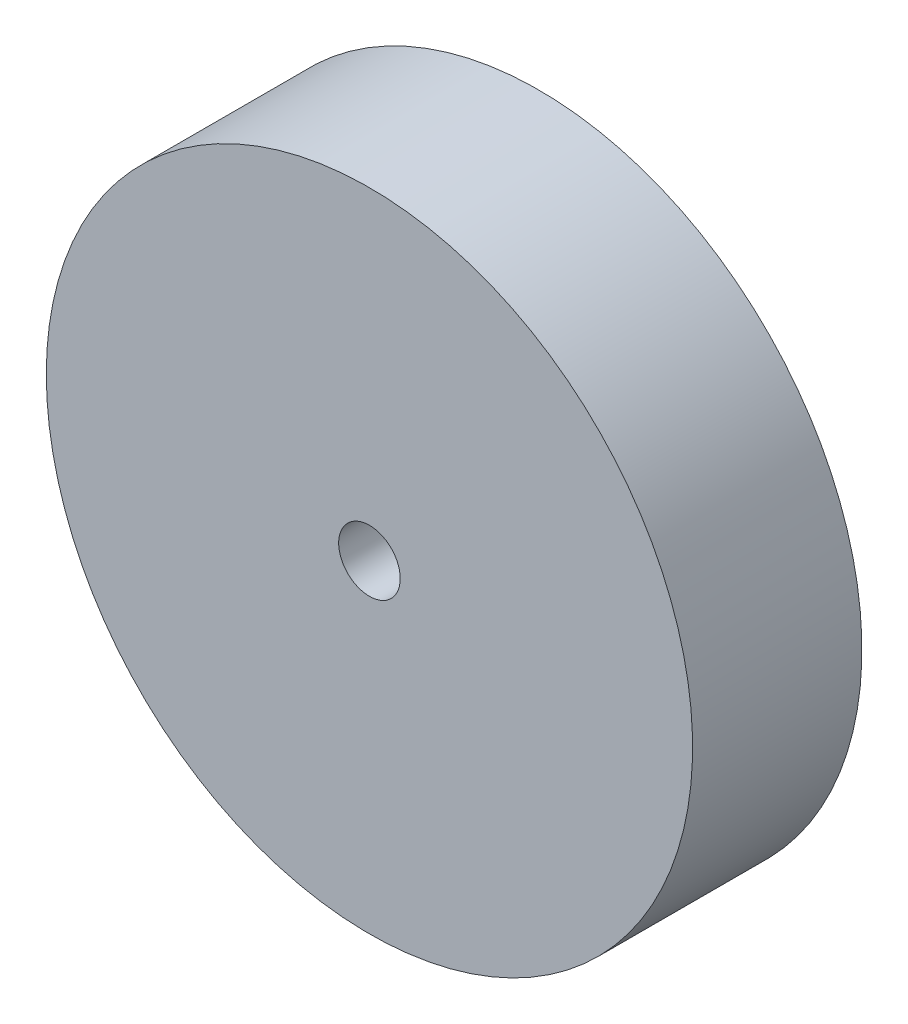
from build123d import *

# Parameters (mm, degrees)
SKETCH1_R                = 88
BOSS_EXTRUDE3_DEPTH      = 25
SKETCH4_W                = 10.4719
SKETCH4_H                = 13.351164338
BOSS_EXTRUDE4_DEPTH      = 25
FILLET2_R                = 4
CIRPATTERN1_COUNT        = 30
FILLET2_OF_CIRPATTERN1_R = 4
SKETCH6_R                = 10
BOSS_EXTRUDE5_DEPTH      = 60
BOSS_EXTRUDE6_START      = 10
SKETCH7_R                = 10
BOSS_EXTRUDE6_DEPTH      = 10
SKETCH8_R                = 10
BOSS_EXTRUDE7_DEPTH      = 10
SKETCH9_R                = 10
BOSS_EXTRUDE8_DEPTH      = 25
SKETCH10_R               = 10
BOSS_EXTRUDE9_DEPTH      = 42.5
SKETCH12_R               = 12.5
CUT_EXTRUDE1_DEPTH       = 12
CUT_EXTRUDE2_START       = -55.5
SKETCH13_R               = 10
CUT_EXTRUDE2_DEPTH       = 55.5
SKETCH14_R               = 10
BOSS_EXTRUDE10_DEPTH     = 440
SKETCH15_R               = 105
BOSS_EXTRUDE12_DEPTH     = 25
BOSS_EXTRUDE13_START     = 30
SKETCH16_R               = 105
BOSS_EXTRUDE13_DEPTH     = 30
SKETCH17_R               = 10
BOSS_EXTRUDE14_DEPTH     = 50
CUT_EXTRUDE3_START       = -700
SKETCH18_R               = 10
CUT_EXTRUDE3_DEPTH       = 700


with BuildPart() as part:
    # Sketch1 → Boss-Extrude3 (new body)
    with BuildSketch(Plane.XY):
        Circle(SKETCH1_R)
    extrude(amount=BOSS_EXTRUDE3_DEPTH)

    # Sketch4 → Boss-Extrude4 (add)
    with BuildSketch(Plane.XY.offset(25)):
        with Locations((0, 93.324417831)):
            Rectangle(SKETCH4_W, SKETCH4_H)
    boss_extrude4 = extrude(amount=-BOSS_EXTRUDE4_DEPTH)

    # Fillet2
    fillet2_edges = [part.edges().sort_by_distance(p)[0] for p in [
        (5.23595, 100, 12.5),
        (0, 100, 0),
        (-5.23595, 100, 12.5),
        (0, 100, 25),
    ]]
    fillet(fillet2_edges, radius=FILLET2_R)

    # CirPattern1: Boss-Extrude4 ×30 about axis
    cirpattern1_axis = Axis((0, 0.317667884, 0), (0, 0, 1))
    for i in range(1, CIRPATTERN1_COUNT):
        add(boss_extrude4.rotate(cirpattern1_axis, i * 360 / CIRPATTERN1_COUNT))

    # Fillet2 of CirPattern1
    fillet2_of_cirpattern1_edges = [part.edges().sort_by_distance(p)[0] for p in [
        (-15.603590285, 98.910317096, 12.5),
        (-20.725122215, 97.821701879, 0),
        (-25.846654145, 96.733086661, 12.5),
        (-20.725122215, 97.821701879, 25),
        (-35.7611788, 93.511662322, 12.5),
        (-40.544457139, 91.382009596, 0),
        (-45.327735478, 89.252356869, 12.5),
        (-40.544457139, 91.382009596, 25),
        (-54.3558322, 84.039982796, 12.5),
        (-58.591804732, 80.962368605, 0),
        (-62.827777264, 77.884754413, 12.5),
        (-58.591804732, 80.962368605, 25),
        (-70.574874905, 70.909236365, 12.5),
        (-74.078409304, 67.018167216, 0),
        (-77.581943702, 63.127098067, 12.5),
        (-74.078409304, 67.018167216, 25),
        (-83.709456921, 54.693299655, 12.5),
        (-86.327431921, 50.158833942, 0),
        (-88.945406921, 45.624368229, 12.5),
        (-86.327431921, 50.158833942, 25),
        (-93.185533987, 36.100886913, 12.5),
        (-94.803531519, 31.121202547, 0),
        (-96.42152905, 26.14151818, 12.5),
        (-94.803531519, 31.121202547, 25),
        (-98.588956064, 15.944575793, 12.5),
        (-99.136261871, 10.737308875, 0),
        (-99.683567678, 5.530041957, 12.5),
        (-99.136261871, 10.737308875, 25),
        (-99.683567678, -4.894706189, 12.5),
        (-99.136261871, -10.101973107, 0),
        (-98.588956064, -15.309240025, 12.5),
        (-99.136261871, -10.101973107, 25),
        (-96.42152905, -25.506182413, 12.5),
        (-94.803531519, -30.485866779, 0),
        (-93.185533987, -35.465551145, 12.5),
        (-94.803531519, -30.485866779, 25),
        (-88.945406921, -44.989032461, 12.5),
        (-86.327431921, -49.523498174, 0),
        (-83.709456921, -54.057963887, 12.5),
        (-86.327431921, -49.523498174, 25),
        (-77.581943702, -62.491762299, 12.5),
        (-74.078409304, -66.382831448, 0),
        (-70.574874905, -70.273900597, 12.5),
        (-74.078409304, -66.382831448, 25),
        (-62.827777264, -77.249418645, 12.5),
        (-58.591804732, -80.327032837, 0),
        (-54.3558322, -83.404647029, 12.5),
        (-58.591804732, -80.327032837, 25),
        (-45.327735478, -88.617021102, 12.5),
        (-40.544457139, -90.746673828, 0),
        (-35.7611788, -92.876326554, 12.5),
        (-40.544457139, -90.746673828, 25),
        (-25.846654145, -96.097750894, 12.5),
        (-20.725122215, -97.186366111, 0),
        (-15.603590285, -98.274981329, 12.5),
        (-20.725122215, -97.186366111, 25),
        (-5.23595, -99.364664232, 12.5),
        (0, -99.364664232, 0),
        (5.23595, -99.364664232, 12.5),
        (0, -99.364664232, 25),
        (15.603590285, -98.274981329, 12.5),
        (20.725122215, -97.186366111, 0),
        (25.846654145, -96.097750894, 12.5),
        (20.725122215, -97.186366111, 25),
        (35.7611788, -92.876326554, 12.5),
        (40.544457139, -90.746673828, 0),
        (45.327735478, -88.617021102, 12.5),
        (40.544457139, -90.746673828, 25),
        (54.3558322, -83.404647029, 12.5),
        (58.591804732, -80.327032837, 0),
        (62.827777264, -77.249418645, 12.5),
        (58.591804732, -80.327032837, 25),
        (70.574874905, -70.273900597, 12.5),
        (74.078409304, -66.382831448, 0),
        (77.581943702, -62.491762299, 12.5),
        (74.078409304, -66.382831448, 25),
        (83.709456921, -54.057963887, 12.5),
        (86.327431921, -49.523498174, 0),
        (88.945406921, -44.989032461, 12.5),
        (86.327431921, -49.523498174, 25),
        (93.185533987, -35.465551145, 12.5),
        (94.803531519, -30.485866779, 0),
        (96.42152905, -25.506182413, 12.5),
        (94.803531519, -30.485866779, 25),
        (98.588956064, -15.309240025, 12.5),
        (99.136261871, -10.101973107, 0),
        (99.683567678, -4.894706189, 12.5),
        (99.136261871, -10.101973107, 25),
        (99.683567678, 5.530041957, 12.5),
        (99.136261871, 10.737308875, 0),
        (98.588956064, 15.944575793, 12.5),
        (99.136261871, 10.737308875, 25),
        (96.42152905, 26.14151818, 12.5),
        (94.803531519, 31.121202547, 0),
        (93.185533987, 36.100886913, 12.5),
        (94.803531519, 31.121202547, 25),
        (88.945406921, 45.624368229, 12.5),
        (86.327431921, 50.158833942, 0),
        (83.709456921, 54.693299655, 12.5),
        (86.327431921, 50.158833942, 25),
        (77.581943702, 63.127098067, 12.5),
        (74.078409304, 67.018167216, 0),
        (70.574874905, 70.909236365, 12.5),
        (74.078409304, 67.018167216, 25),
        (62.827777264, 77.884754413, 12.5),
        (58.591804732, 80.962368605, 0),
        (54.3558322, 84.039982796, 12.5),
        (58.591804732, 80.962368605, 25),
        (45.327735478, 89.252356869, 12.5),
        (40.544457139, 91.382009596, 0),
        (35.7611788, 93.511662322, 12.5),
        (40.544457139, 91.382009596, 25),
        (25.846654145, 96.733086661, 12.5),
        (20.725122215, 97.821701879, 0),
        (15.603590285, 98.910317096, 12.5),
        (20.725122215, 97.821701879, 25),
    ]]
    fillet(fillet2_of_cirpattern1_edges, radius=FILLET2_OF_CIRPATTERN1_R)

    # Sketch6 → Boss-Extrude5 (add)
    with BuildSketch(Plane.XY.offset(25)):
        Circle(SKETCH6_R)
    extrude(amount=BOSS_EXTRUDE5_DEPTH)

    # Sketch7 → Boss-Extrude6 (add)
    with BuildSketch(Plane(origin=(0, 0, 0), x_dir=(-1, 0, 0), z_dir=(0, 0, -1)).offset(BOSS_EXTRUDE6_START)):
        with Locations(Location((0, 0, 0), (0, 0, 180))):
            Circle(SKETCH7_R)
    extrude(amount=-BOSS_EXTRUDE6_DEPTH)

    # Sketch8 → Boss-Extrude7 (add)
    with BuildSketch(Plane.XY.offset(85)):
        Circle(SKETCH8_R)
    extrude(amount=BOSS_EXTRUDE7_DEPTH)

    # Sketch9 → Boss-Extrude8 (add)
    with BuildSketch(Plane.XY.offset(95)):
        Circle(SKETCH9_R)
    extrude(amount=BOSS_EXTRUDE8_DEPTH)

    # Sketch10 → Boss-Extrude9 (add)
    with BuildSketch(Plane.XY.offset(120)):
        Circle(SKETCH10_R)
    extrude(amount=BOSS_EXTRUDE9_DEPTH)

    # Sketch12 → Cut-Extrude1 (cut)
    with BuildSketch(Plane.XY.offset(162.5)):
        Circle(SKETCH12_R)
    extrude(amount=-CUT_EXTRUDE1_DEPTH, mode=Mode.SUBTRACT)

    # Sketch13 → Cut-Extrude2 (cut)
    with BuildSketch(Plane.XY.offset(150.5).offset(CUT_EXTRUDE2_START)):
        Circle(SKETCH13_R)
    extrude(amount=CUT_EXTRUDE2_DEPTH, mode=Mode.SUBTRACT)

    # Sketch14 → Boss-Extrude10 (add)
    with BuildSketch(Plane.XY.offset(95)):
        Circle(SKETCH14_R)
    extrude(amount=BOSS_EXTRUDE10_DEPTH)

    # Sketch15 → Boss-Extrude12 (add)
    with BuildSketch(Plane(origin=(0, 0, 0), x_dir=(-1, 0, 0), z_dir=(0, 0, -1))):
        Circle(SKETCH15_R)
    extrude(amount=-BOSS_EXTRUDE12_DEPTH)

    # Sketch16 → Boss-Extrude13 (add)
    with BuildSketch(Plane(origin=(0, 0, 0), x_dir=(-1, 0, 0), z_dir=(0, 0, -1)).offset(BOSS_EXTRUDE13_START)):
        Circle(SKETCH16_R)
    extrude(amount=-BOSS_EXTRUDE13_DEPTH)

    # Sketch17 → Boss-Extrude14 (add)
    with BuildSketch(Plane.XY.offset(535)):
        Circle(SKETCH17_R)
    extrude(amount=BOSS_EXTRUDE14_DEPTH)

    # Sketch18 → Cut-Extrude3 (cut)
    with BuildSketch(Plane.XY.offset(585).offset(CUT_EXTRUDE3_START)):
        Circle(SKETCH18_R)
    extrude(amount=CUT_EXTRUDE3_DEPTH, mode=Mode.SUBTRACT)


solid = part.part
